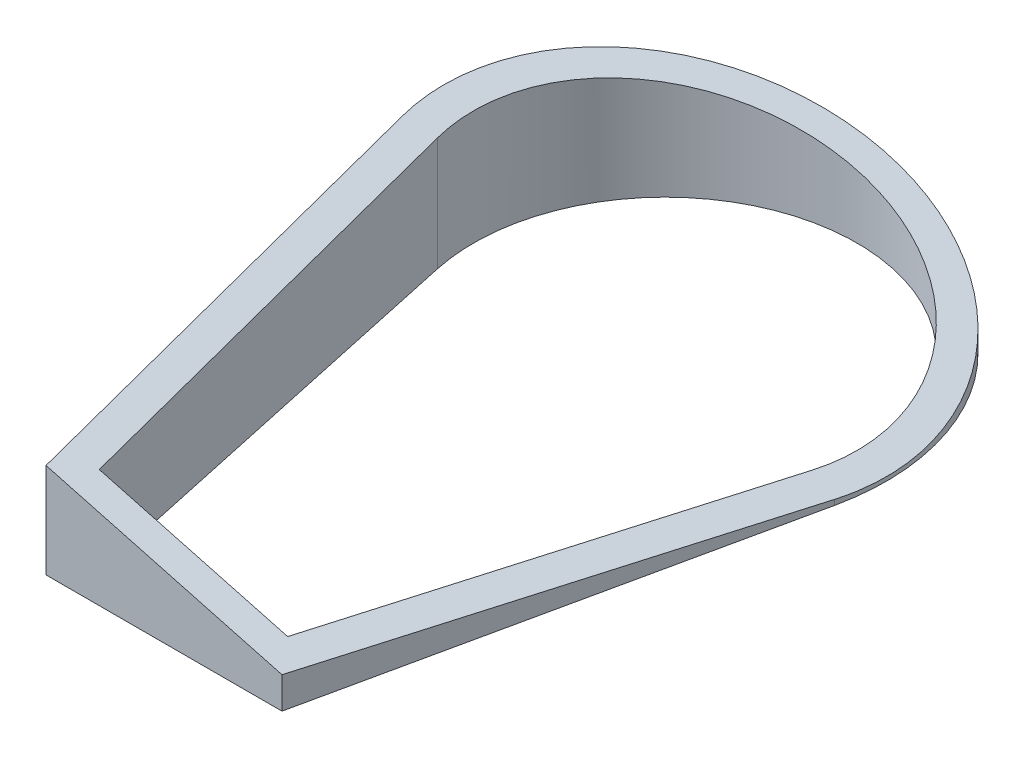
from build123d import *

# Parameters (mm, degrees)
EXTRUDE_1_DEPTH     = 70
CUT_EXTRUDE_1_DEPTH = 266.612499706


with BuildPart() as part:
    # 草图1 → 凸台-拉伸1 (new body)
    with BuildSketch(Plane(origin=(0, 0, 0), x_dir=(1, 0, 0), z_dir=(0, 1, 0))):
        with BuildLine():
            Line((-73.31, -15.831737113), (-40.016432831, -170))
            Line((-40.016432831, -170), (40.016432831, -170))
            Line((40.016432831, -170), (73.31, -15.831737113))
            ThreePointArc((73.31, -15.831737113), (0, 75), (-73.31, -15.831737113))
        make_face()
        with BuildLine():
            Line((-63.535333333, -13.720838831), (-31.945465312, -160))
            Line((-31.945465312, -160), (31.945465312, -160))
            Line((31.945465312, -160), (63.535333333, -13.720838831))
            ThreePointArc((63.535333333, -13.720838831), (0, 65), (-63.535333333, -13.720838831))
        make_face(mode=Mode.SUBTRACT)
    extrude(amount=EXTRUDE_1_DEPTH)

    # 草图2 → 切除-拉伸1 (cut, through all)
    with BuildSketch(Plane.XY.offset(170)):
        Polygon((-80, 42.871870789), (80, 0), (80, 71.175543423), (-80, 71.175543423), align=None)
    extrude(amount=-CUT_EXTRUDE_1_DEPTH, mode=Mode.SUBTRACT)


solid = part.part
